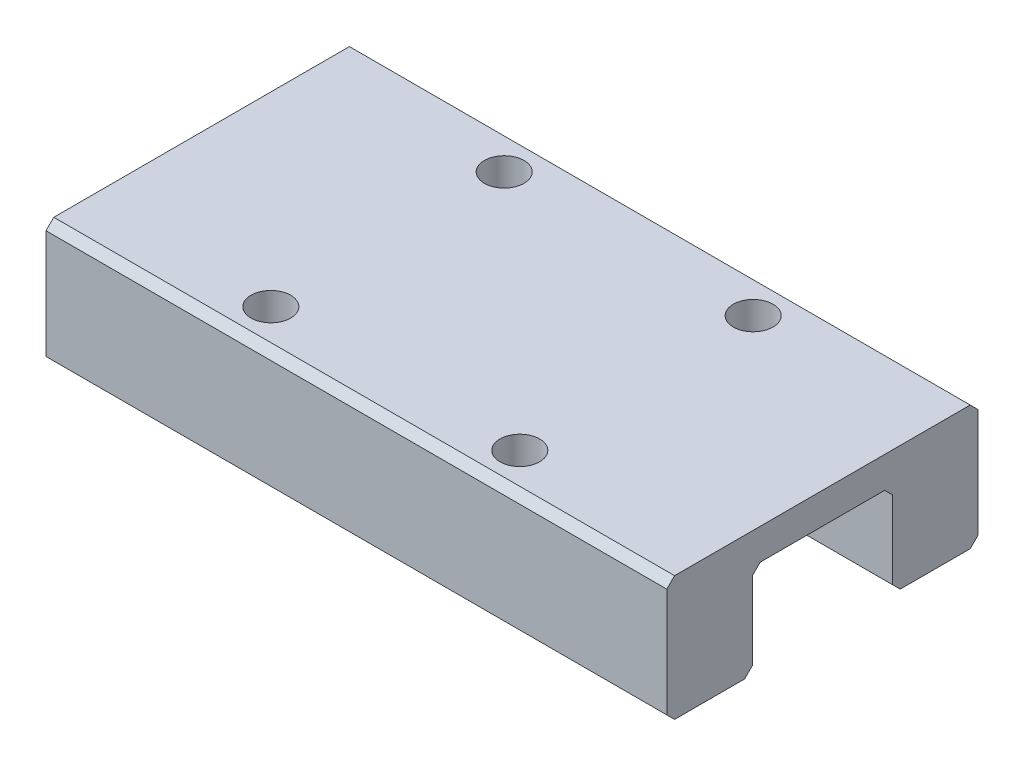
from build123d import *

# Parameters (mm, degrees)
EXTRUDE_1_DEPTH     = 39.9
CHAMFER_1_SIZE      = 0.5
SKETCH_3_R          = 1.275
CUT_EXTRUDE_2_DEPTH = 3


with BuildPart() as part:
    # 草图2 → 拉伸1 (new body)
    with BuildSketch(Plane(origin=(0, 0, 0), x_dir=(0, 0, -1), z_dir=(1, 0, 0))):
        Polygon((-4.5, 0), (4.5, 0), (4.5, -6), (10, -6), (10, 2), (-10, 2), (-10, -6), (-4.5, -6), align=None)
    extrude(amount=EXTRUDE_1_DEPTH)

    # 倒角1
    chamfer_1_edges = [part.edges().sort_by_distance(p)[0] for p in [
        (19.95, -6, 10),
        (19.95, 2, 10),
        (19.95, 2, -10),
        (19.95, -6, -10),
        (19.95, -6, -4.5),
        (19.95, 0, -4.5),
        (19.95, 0, 4.5),
        (19.95, -6, 4.5),
    ]]
    chamfer(chamfer_1_edges, length=CHAMFER_1_SIZE)

    # 草图3 → 拉伸2 (cut)
    with BuildSketch(Plane(origin=(0, 2, 0), x_dir=(1, 0, 0), z_dir=(0, 1, 0))):
        with Locations(Location((11.95, 7.5, 0), (0, 0, 270))):
            Circle(SKETCH_3_R)
        with Locations(Location((27.95, 7.5, 0), (0, 0, 90))):
            Circle(SKETCH_3_R)
        with Locations(Location((27.95, -7.5, 0), (0, 0, 270))):
            Circle(SKETCH_3_R)
        with Locations(Location((11.95, -7.5, 0), (0, 0, 90))):
            Circle(SKETCH_3_R)
    extrude(amount=-CUT_EXTRUDE_2_DEPTH, mode=Mode.SUBTRACT)


solid = part.part
